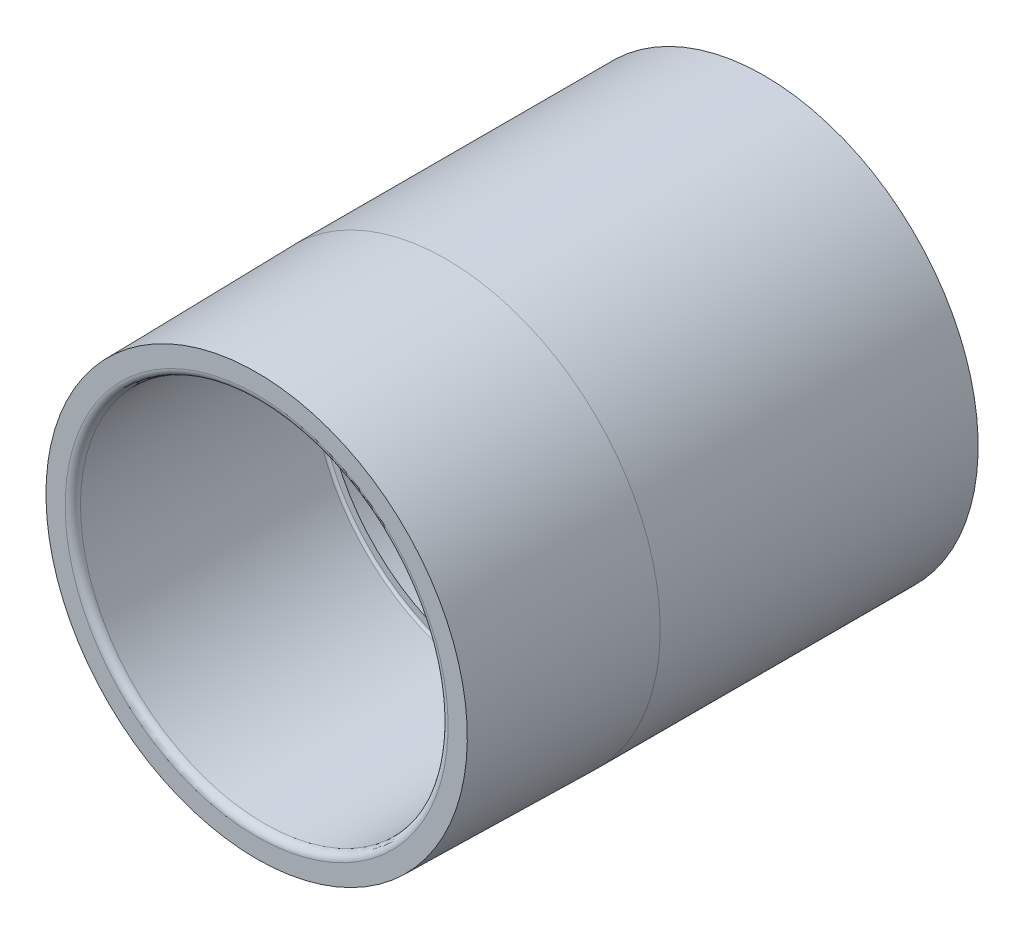
from build123d import *

# Parameters (mm, degrees)
FILLET1_R = 1.524
FILLET2_R = 0.508


with BuildPart() as part:
    # Sketch3 → Revolve1 (revolve)
    with BuildSketch(Plane(origin=(0, 0, 0), x_dir=(0, 0, -1), z_dir=(1, 0, 0))):
        Polygon((-12.813309339, -42.7101), (50.6476, -42.7101), (50.6476, -36.6903), (2.3876, -36.6903), (2.3876, -34.798), (-2.3876, -34.798), (-2.3876, -36.6903), (-50.6476, -36.6903), (-50.6476, -42.0497), align=None)
    revolve(axis=Axis((0, 0, 50.6476), (0, 0, -1)))

    # Fillet1
    fillet1_edges = [part.edges().sort_by_distance(p)[0] for p in [
        (0, 36.6903, -50.6476),
        (0, 36.6903, 50.6476),
    ]]
    fillet(fillet1_edges, radius=FILLET1_R)

    # Fillet2
    fillet2_edges = [part.edges().sort_by_distance(p)[0] for p in [
        (0, 36.6903, 2.3876),
        (0, 36.6903, -2.3876),
    ]]
    fillet(fillet2_edges, radius=FILLET2_R)


solid = part.part
